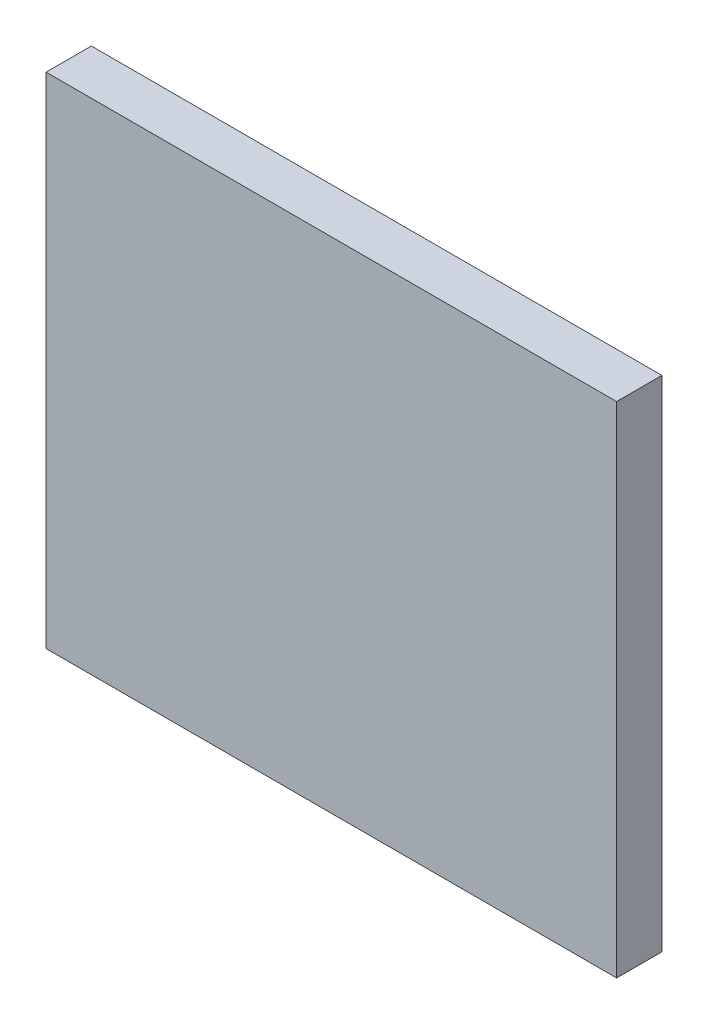
from build123d import *

# Parameters (mm, degrees)
SKETCH1_W           = 320
SKETCH1_H           = 280
BOSS_EXTRUDE1_DEPTH = 25.4


with BuildPart() as part:
    # Sketch1 → Boss-Extrude1 (new body)
    with BuildSketch(Plane.XY):
        Rectangle(SKETCH1_W, SKETCH1_H)
    extrude(amount=BOSS_EXTRUDE1_DEPTH)


solid = part.part
